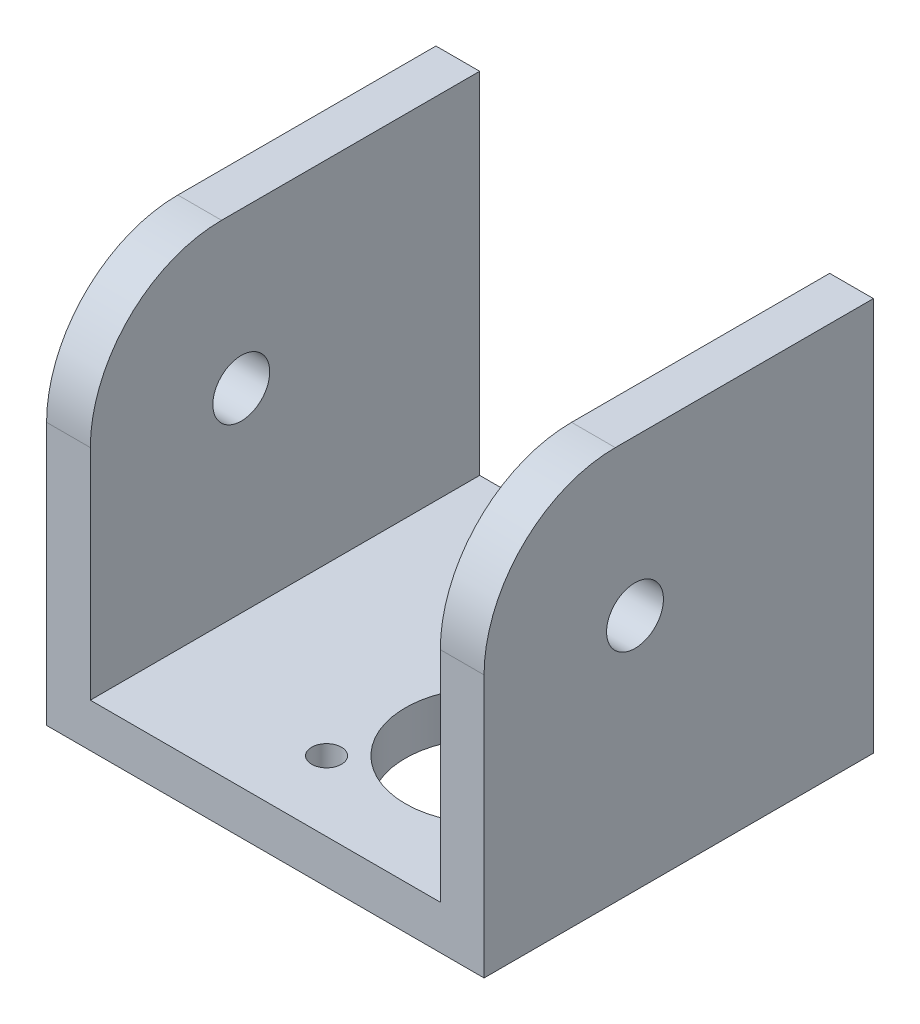
from build123d import *

# Parameters (mm, degrees)
ESQUISSE1_W             = 50
ESQUISSE1_H             = 45
BOSS_EXTRU_1_DEPTH      = 44.5
ESQUISSE2_W             = 40
ESQUISSE2_H             = 40
ENL_V_MAT_EXTRU_1_DEPTH = 44.5
ESQUISSE3_R             = 9.5
ESQUISSE3_R_2           = 1.5
ENL_V_MAT_EXTRU_2_DEPTH = 5
D_GAGEMENT_M31_D        = 3.4
CONG_1_R                = 15
ENL_V_MAT_EXTRU_3_REACH = 82.655
ESQUISSE7_R             = 3.25


with BuildPart() as part:
    # Esquisse1 → Boss.-Extru.1 (new body)
    with BuildSketch(Plane.XY):
        with Locations((25, 22.5)):
            Rectangle(ESQUISSE1_W, ESQUISSE1_H)
    extrude(amount=BOSS_EXTRU_1_DEPTH)

    # Esquisse2 → Enlèv. mat.-Extru.1 (cut)
    with BuildSketch(Plane.XY.offset(44.5)):
        with Locations((25, 25)):
            Rectangle(ESQUISSE2_W, ESQUISSE2_H)
    extrude(amount=-ENL_V_MAT_EXTRU_1_DEPTH, mode=Mode.SUBTRACT)

    # Esquisse3 → Enlèv. mat.-Extru.2 (cut)
    with BuildSketch(Plane(origin=(0, 5, 0), x_dir=(1, 0, 0), z_dir=(0, 1, 0))):
        with Locations(Location((33.25, -27.25, 0), (0, 0, 270))):
            Circle(ESQUISSE3_R)
        with Locations(Location((42.5, -18, 0), (0, 0, 270))):
            Circle(ESQUISSE3_R_2)
        with Locations(Location((24, -18, 0), (0, 0, 270))):
            Circle(ESQUISSE3_R_2)
        with Locations(Location((24, -36.5, 0), (0, 0, 270))):
            Circle(ESQUISSE3_R_2)
        with Locations(Location((42.5, -36.5, 0), (0, 0, 270))):
            Circle(ESQUISSE3_R_2)
    extrude(amount=-ENL_V_MAT_EXTRU_2_DEPTH, mode=Mode.SUBTRACT)

    # Dégagement M31 (through all)
    with Locations(Plane(origin=(0, 5, 0), x_dir=(1, 0, 0), z_dir=(0, 1, 0))):
        with Locations((42.5, -18), (24, -18), (24, -36.5), (42.5, -36.5)):
            Hole(D_GAGEMENT_M31_D / 2)

    # Congé1
    cong_1_edges = [part.edges().sort_by_distance(p)[0] for p in [
        (2.5, 45, 44.5),
        (47.5, 45, 44.5),
    ]]
    fillet(cong_1_edges, radius=CONG_1_R)

    # Enlèv. mat.-Extru.3: up to this face of the body (flat: up to its plane)
    enl_v_mat_extru_3_end = Plane(part.part.faces().sort_by_distance((0, 22.02684797, 21.783025057))[0])
    # Esquisse7 → Enlèv. mat.-Extru.3 (cut, up to the picked face)
    with BuildSketch(Plane(origin=(50, 0, 0), x_dir=(0, 0, -1), z_dir=(1, 0, 0)), mode=Mode.PRIVATE) as enl_v_mat_extru_3_sk1:
        with Locations((-27.25, 27.25)):
            Circle(ESQUISSE7_R)
    enl_v_mat_extru_3_tool1 = split(extrude(enl_v_mat_extru_3_sk1.sketch, amount=-ENL_V_MAT_EXTRU_3_REACH, mode=Mode.PRIVATE), bisect_by=enl_v_mat_extru_3_end, keep=Keep.BOTH, mode=Mode.PRIVATE)
    add(enl_v_mat_extru_3_tool1.solids().sort_by(Axis((50, 27.25, 27.25), (-1, 0, 0)))[0], mode=Mode.SUBTRACT)


solid = part.part
